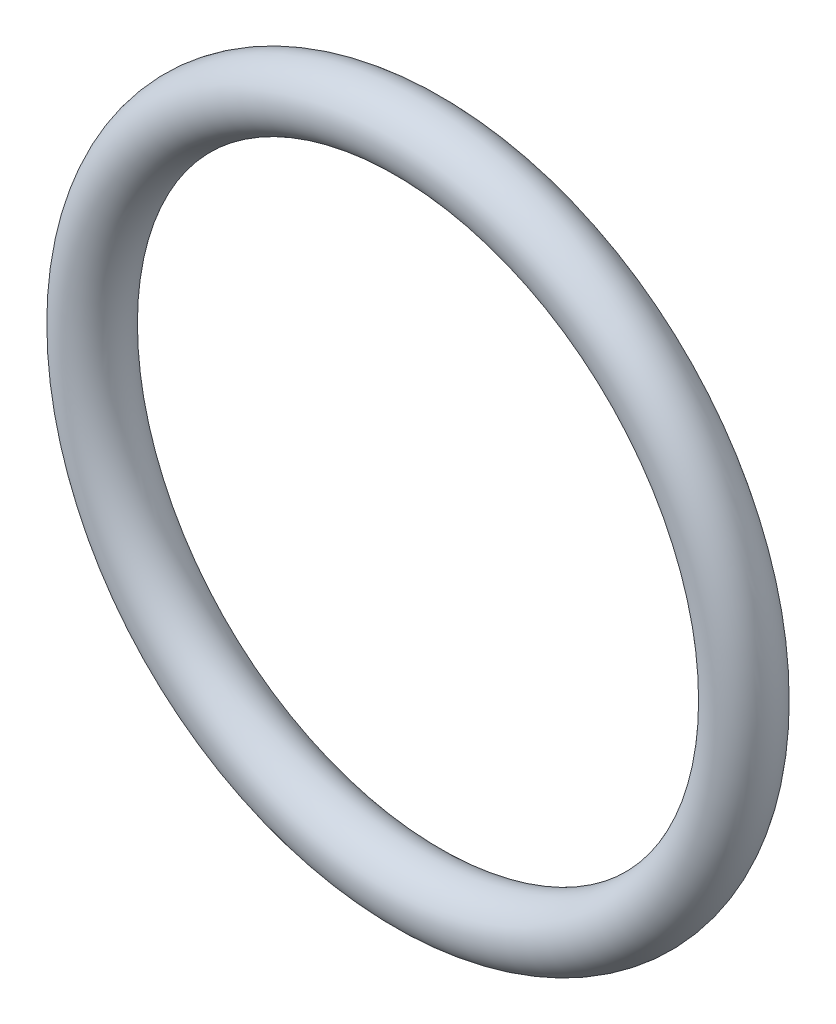
from build123d import *

# Parameters (mm, degrees)
SKETCH2_R = 0.762


with BuildPart() as part:
    # Sketch2 → Revolve1 (revolve)
    with BuildSketch(Plane(origin=(0, 0, 0), x_dir=(1, 0, 0), z_dir=(0, 1, 0)), mode=Mode.PRIVATE) as revolve1_sk:
        with Locations((7.747, 0)):
            Circle(SKETCH2_R)
    revolve(revolve1_sk.sketch.rotate(Axis((0, 0, -9.87070751), (0, 0, 1)), 180), axis=Axis((0, 0, -9.87070751), (0, 0, 1)))


solid = part.part
